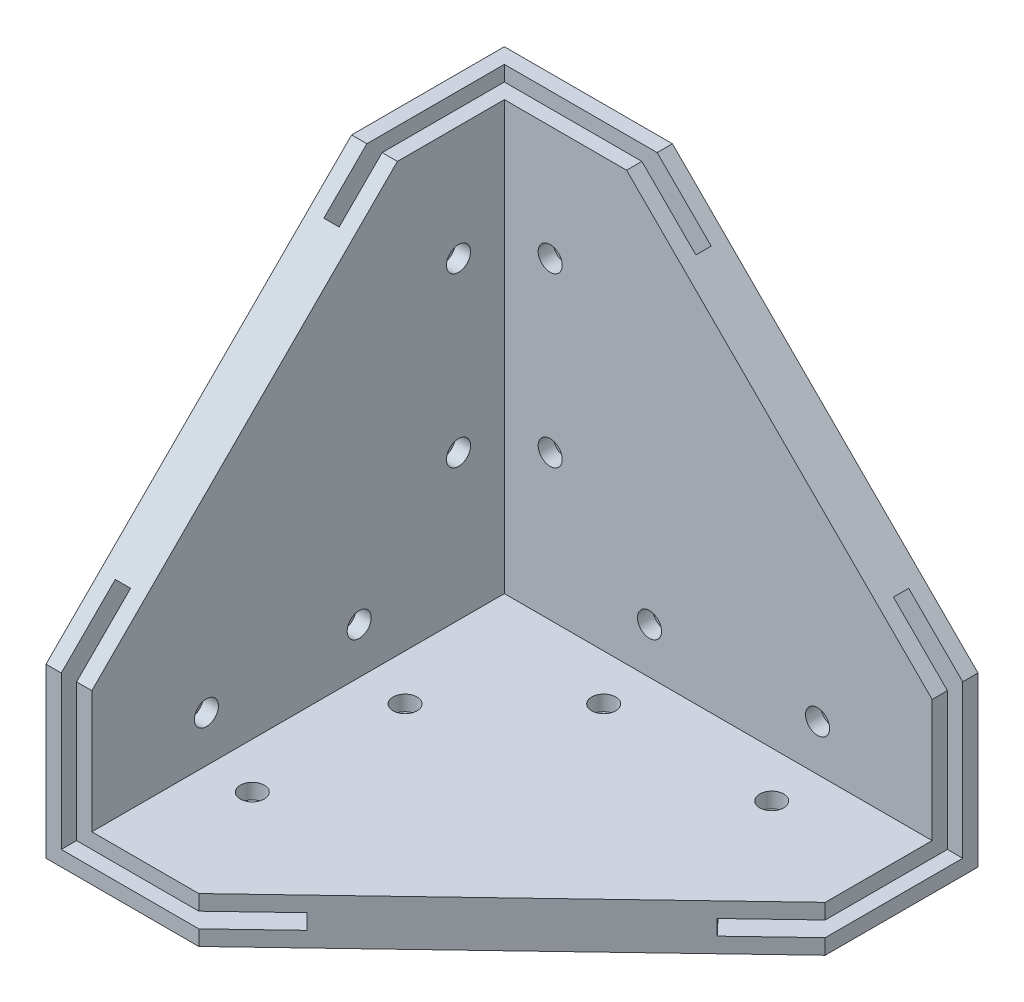
from build123d import *

# Parameters (mm, degrees)
BOSS_EXTRUDE1_DEPTH = 2.54
BOSS_EXTRUDE2_DEPTH = 2.54
BOSS_EXTRUDE3_DEPTH = 2.54
SKETCH6_W           = 2.54
SKETCH6_H           = 76.2
BOSS_EXTRUDE4_DEPTH = 76.2
CUT_EXTRUDE1_REACH  = 133.982
SKETCH8_W           = 2.54
SKETCH8_H           = 78.74
BOSS_EXTRUDE5_DEPTH = 76.2
CUT_EXTRUDE2_REACH  = 133.982
SKETCH10_W          = 78.74
SKETCH10_H          = 2.54
BOSS_EXTRUDE6_DEPTH = 76.2
CUT_EXTRUDE3_REACH  = 133.982
CUT_EXTRUDE5_DEPTH  = 132.982271537
CUT_EXTRUDE6_DEPTH  = 132.982271537
CUT_EXTRUDE9_DEPTH  = 76.2
BOSS_EXTRUDE7_DEPTH = 7.62
BOSS_EXTRUDE8_DEPTH = 5.08
BOSS_EXTRUDE9_DEPTH = 5.08
SKETCH34_R          = 2
CUT_EXTRUDE11_DEPTH = 12.7
SKETCH35_R          = 2
CUT_EXTRUDE13_DEPTH = 12.7
SKETCH36_R          = 2
CUT_EXTRUDE14_DEPTH = 12.7


with BuildPart() as part:
    # Sketch1 → Boss-Extrude1 (new body)
    with BuildSketch(Plane.XY):
        Polygon((0, 76.2), (0, 0), (76.2, 0), (76.2, 25.4), (25.4, 76.2), align=None)
    extrude(amount=BOSS_EXTRUDE1_DEPTH)

    # Sketch3 → Boss-Extrude2 (add)
    with BuildSketch(Plane.ZY):
        Polygon((0, 76.2), (25.4, 76.2), (76.2, 25.4), (76.2, 0), (0, 0), align=None)
    extrude(amount=BOSS_EXTRUDE2_DEPTH)

    # Sketch5 → Boss-Extrude3 (add)
    with BuildSketch(Plane.XZ):
        Polygon((-2.54, 76.2), (-2.54, 0), (76.2, 0), (76.2, 25.4), (22.86, 76.2), align=None)
    extrude(amount=BOSS_EXTRUDE3_DEPTH)

    # Sketch6 → Boss-Extrude4 (add)
    with BuildSketch(Plane.XY):
        with Locations((3.81, 38.1)):
            Rectangle(SKETCH6_W, SKETCH6_H)
    extrude(amount=BOSS_EXTRUDE4_DEPTH)

    # Sketch7 → Cut-Extrude1 (cut, up to next)
    with BuildSketch(Plane(origin=(0, 0, 0), x_dir=(0, 0, -1), z_dir=(1, 0, 0)), mode=Mode.PRIVATE) as cut_extrude1_sk1:
        Polygon((-25.4, 76.2), (-76.2, 25.4), (-76.2, 76.2), align=None)
    cut_extrude1_tool1 = extrude(cut_extrude1_sk1.sketch, amount=CUT_EXTRUDE1_REACH, mode=Mode.PRIVATE) & part.part
    add(cut_extrude1_tool1.solids().sort_by_distance((0, 59.266667, 59.266667))[0], mode=Mode.SUBTRACT)

    # Sketch8 → Boss-Extrude5 (add)
    with BuildSketch(Plane(origin=(0, 0, 0), x_dir=(0, 0, -1), z_dir=(1, 0, 0))):
        with Locations((-6.35, 36.83)):
            Rectangle(SKETCH8_W, SKETCH8_H)
    extrude(amount=BOSS_EXTRUDE5_DEPTH)

    # Sketch9 → Cut-Extrude2 (cut, up to next)
    with BuildSketch(Plane.XY, mode=Mode.PRIVATE) as cut_extrude2_sk1:
        Polygon((76.2, 25.4), (25.4, 76.2), (76.2, 76.2), align=None)
    cut_extrude2_tool1 = extrude(cut_extrude2_sk1.sketch, amount=CUT_EXTRUDE2_REACH, mode=Mode.PRIVATE) & part.part
    add(cut_extrude2_tool1.solids().sort_by_distance((59.266667, 59.266667, 0))[0], mode=Mode.SUBTRACT)

    # Sketch10 → Boss-Extrude6 (add)
    with BuildSketch(Plane.XY):
        with Locations((36.83, 3.81)):
            Rectangle(SKETCH10_W, SKETCH10_H)
    extrude(amount=BOSS_EXTRUDE6_DEPTH)

    # Sketch11 → Cut-Extrude3 (cut, up to next)
    with BuildSketch(Plane(origin=(0, 0, 0), x_dir=(1, 0, 0), z_dir=(0, 1, 0)), mode=Mode.PRIVATE) as cut_extrude3_sk1:
        Polygon((22.86, -76.2), (76.2, -25.4), (76.2, -76.2), align=None)
    cut_extrude3_tool1 = extrude(cut_extrude3_sk1.sketch, amount=CUT_EXTRUDE3_REACH, mode=Mode.PRIVATE) & part.part
    add(cut_extrude3_tool1.solids().sort_by_distance((58.42, 0, 59.266667))[0], mode=Mode.SUBTRACT)

    # Sketch12 → Cut-Extrude5 (cut, through all)
    with BuildSketch(Plane(origin=(0, 0, 0), x_dir=(0, 0, -1), z_dir=(1, 0, 0))):
        Polygon((-5.08, 5.08), (-5.08, 2.54), (-7.62, 2.54), (-7.62, 0), (-2.54, 0), (-2.54, 5.08), align=None)
    extrude(amount=CUT_EXTRUDE5_DEPTH, mode=Mode.SUBTRACT)

    # Sketch13 → Cut-Extrude6 (cut, through all)
    with BuildSketch(Plane(origin=(0, 0, 0), x_dir=(1, 0, 0), z_dir=(0, 1, 0))):
        Polygon((0, -2.54), (0, -7.62), (2.54, -7.62), (2.54, -5.08), (5.08, -5.08), (5.08, -2.54), align=None)
    extrude(amount=CUT_EXTRUDE6_DEPTH, mode=Mode.SUBTRACT)

    # Sketch15 → Cut-Extrude9 (cut)
    with BuildSketch(Plane.XY.offset(2.54)):
        Polygon((2.54, 5.08), (0, 5.08), (0, 0), (5.08, 0), (5.08, 2.54), (2.54, 2.54), align=None)
    extrude(amount=CUT_EXTRUDE9_DEPTH, mode=Mode.SUBTRACT)


with BuildPart() as cut_extrude9_piece_1:
    # of the separate pieces the step leaves, piece 1, a body of its own (cut_extrude9_pieces)
    add(part.part.solids().sort_by_distance((0, 0, 2.54))[0])



with BuildPart() as cut_extrude9_piece_2:
    # of the separate pieces the step leaves, piece 2, a body of its own (cut_extrude9_pieces)
    add(part.part.solids().sort_by_distance((2.54, 2.54, 76.2))[0])


with BuildPart() as cut_extrude9_piece_1_1:
    add(cut_extrude9_piece_1.part)

    add(cut_extrude9_piece_2.part)  # Boss-Extrude7 merges Cut-Extrude9 piece 2
    # Sketch17 → Boss-Extrude7 (add)
    with BuildSketch(Plane(origin=(0, 0, 0), x_dir=(-1, 0, 0), z_dir=(0, 0, -1))):
        Polygon((-67.219743879, 34.380256121), (-34.380256121, 67.219743879), (-30.788153673, 63.627641431), (-63.627641431, 30.788153673), align=None)
    extrude(amount=-BOSS_EXTRUDE7_DEPTH)

    # Sketch18 → Boss-Extrude8 (add)
    with BuildSketch(Plane(origin=(0, 0, 0), x_dir=(1, 0, 0), z_dir=(0, 1, 0))):
        Polygon((32.056551724, -67.44137931), (67.003448276, -34.15862069), (63.5, -30.48), (28.553103448, -63.762758621), align=None)
    extrude(amount=BOSS_EXTRUDE8_DEPTH)

    # Sketch19 → Boss-Extrude9 (add)
    with BuildSketch(Plane(origin=(0, 0, 0), x_dir=(0, 0, -1), z_dir=(1, 0, 0))):
        Polygon((-32.545001849, 69.054998151), (-67.219743879, 34.380256121), (-63.627641431, 30.788153673), (-28.9528994, 65.462895703), align=None)
    extrude(amount=BOSS_EXTRUDE9_DEPTH)

    # Sketch34 → Cut-Extrude11 (cut, symmetric)
    with BuildSketch(Plane(origin=(0, 0, 0), x_dir=(0, 0, -1), z_dir=(1, 0, 0))):
        with Locations((-15.24, 57.15)):
            Circle(SKETCH34_R)
        with Locations((-15.24, 29.21)):
            Circle(SKETCH34_R)
        with Locations((-31.75, 12.7)):
            Circle(SKETCH34_R)
        with Locations((-57.15, 12.7)):
            Circle(SKETCH34_R)
    extrude(amount=CUT_EXTRUDE11_DEPTH, both=True, mode=Mode.SUBTRACT)

    # Sketch35 → Cut-Extrude13 (cut, symmetric)
    with BuildSketch(Plane(origin=(0, 0, 0), x_dir=(1, 0, 0), z_dir=(0, 1, 0))):
        with Locations(Location((12.7, -57.15, 0), (0, 0, 270))):
            Circle(SKETCH35_R)
        with Locations(Location((12.7, -31.75, 0), (0, 0, 270))):
            Circle(SKETCH35_R)
        with Locations(Location((29.21, -15.24, 0), (0, 0, 270))):
            Circle(SKETCH35_R)
        with Locations(Location((57.15, -15.24, 0), (0, 0, 270))):
            Circle(SKETCH35_R)
    extrude(amount=CUT_EXTRUDE13_DEPTH, both=True, mode=Mode.SUBTRACT)

    # Sketch36 → Cut-Extrude14 (cut, symmetric)
    with BuildSketch(Plane.XY):
        with Locations((57.15, 12.7)):
            Circle(SKETCH36_R)
        with Locations((29.21, 12.7)):
            Circle(SKETCH36_R)
        with Locations((12.7, 29.21)):
            Circle(SKETCH36_R)
        with Locations((12.7, 57.15)):
            Circle(SKETCH36_R)
    extrude(amount=CUT_EXTRUDE14_DEPTH, both=True, mode=Mode.SUBTRACT)


solid = cut_extrude9_piece_1_1.part
